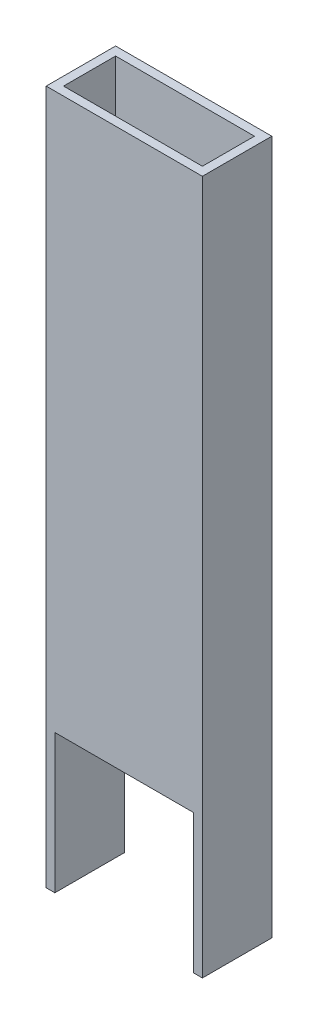
from build123d import *

# Parameters (mm, degrees)
BOSS_EXTRUDE2_DEPTH = 12.7
SKETCH2_W           = 50.8
SKETCH2_H           = 19.05
CUT_EXTRUDE1_DEPTH  = 256.917605149


with BuildPart() as part:
    # Sketch1 → Boss-Extrude2 (new, symmetric)
    with BuildSketch(Plane.XY):
        Polygon((-25.4, -127), (-25.4, -76.2), (25.4, -76.2), (25.4, -127), (28.575, -127), (28.575, 127), (-28.575, 127), (-28.575, -127), align=None)
    extrude(amount=BOSS_EXTRUDE2_DEPTH, both=True)

    # Sketch2 → Cut-Extrude1 (cut, through all)
    with BuildSketch(Plane(origin=(0, 127, 0), x_dir=(1, 0, 0), z_dir=(0, 1, 0))):
        Rectangle(SKETCH2_W, SKETCH2_H)
    extrude(amount=-CUT_EXTRUDE1_DEPTH, mode=Mode.SUBTRACT)


solid = part.part
